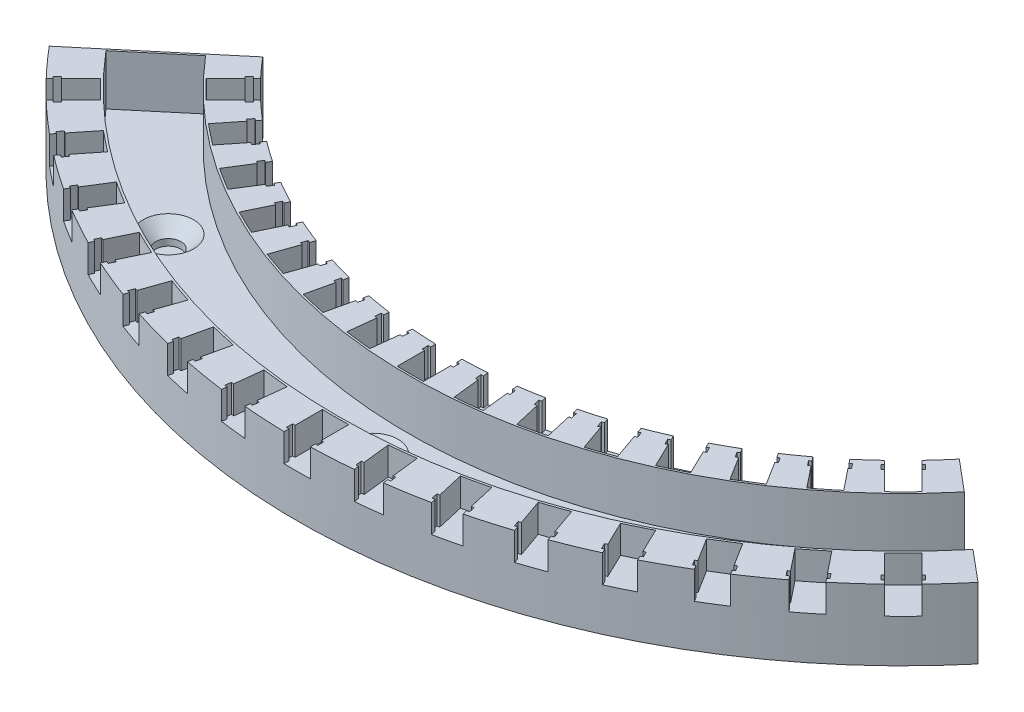
from build123d import *

# Parameters (mm, degrees)
BOSS_EXTRUDE1_DEPTH             = 4
BOSS_EXTRUDE2_START             = 10
BOSS_EXTRUDE2_DEPTH             = 10
SKETCH2_W                       = 5.2
SKETCH2_H                       = 1.2
SKETCH2_W_2                     = 0.5
SKETCH2_H_2                     = 5.837563394
SKETCH2_H_3                     = 1
CUT_EXTRUDE1_DEPTH              = 5.5
CIRPATTERN1_COUNT               = 8
CIRPATTERN1_ANGLE               = 45
CIRPATTERN1_THE_OTHER_WAY_COUNT = 8
CIRPATTERN1_THE_OTHER_WAY_ANGLE = 45
BOSS_EXTRUDE3_START             = 10
BOSS_EXTRUDE3_DEPTH             = 10
SKETCH4_R                       = 2.5
CUT_EXTRUDE2_DEPTH              = 3.8
CHAMFER1_SIZE                   = 2.5


with BuildPart() as part:
    # Sketch1 → Boss-Extrude1 (new body)
    with BuildSketch(Plane(origin=(0, 0, 0), x_dir=(1, 0, 0), z_dir=(0, 1, 0))):
        with BuildLine():
            ThreePointArc((68.943999881, -57.850884872), (38.035643557, -81.567700833), (0, -90))
            Line((0, -90), (0, -98))
            ThreePointArc((0, -98), (41.416589651, -88.81816313), (75.072355426, -62.993185749))
            Line((75.072355426, -62.993185749), (68.943999881, -57.850884872))
        make_face()
        with BuildLine():
            Line((0, -98), (0, -90))
            ThreePointArc((0, -90), (-38.035643557, -81.567700833), (-68.943999881, -57.850884872))
            Line((-68.943999881, -57.850884872), (-75.072355426, -62.993185749))
            ThreePointArc((-75.072355426, -62.993185749), (-41.416589651, -88.81816313), (0, -98))
        make_face()
        with BuildLine():
            Line((0, -112), (0, -98))
            ThreePointArc((0, -98), (-41.416589651, -88.81816313), (-75.072355426, -62.993185749))
            Line((-75.072355426, -62.993185749), (-85.796977629, -71.992212285))
            ThreePointArc((-85.796977629, -71.992212285), (-47.333245315, -101.506472148), (0, -112))
        make_face()
        with BuildLine():
            Line((0, -120), (0, -112))
            ThreePointArc((0, -112), (-47.333245315, -101.506472148), (-85.796977629, -71.992212285))
            Line((-85.796977629, -71.992212285), (-91.925333174, -77.134513162))
            ThreePointArc((-91.925333174, -77.134513162), (-50.714191409, -108.756934444), (0, -120))
        make_face()
        with BuildLine():
            ThreePointArc((75.072355426, -62.993185749), (41.416589651, -88.81816313), (0, -98))
            Line((0, -98), (0, -112))
            ThreePointArc((0, -112), (47.333245315, -101.506472148), (85.796977629, -71.992212285))
            Line((85.796977629, -71.992212285), (75.072355426, -62.993185749))
        make_face()
        with BuildLine():
            ThreePointArc((85.796977629, -71.992212285), (47.333245315, -101.506472148), (0, -112))
            Line((0, -112), (0, -120))
            ThreePointArc((0, -120), (50.714191409, -108.756934444), (91.925333174, -77.134513162))
            Line((91.925333174, -77.134513162), (85.796977629, -71.992212285))
        make_face()
    extrude(amount=-BOSS_EXTRUDE1_DEPTH)

    # Sketch1<3> → Boss-Extrude2 (add)
    with BuildSketch(Plane(origin=(0, 0, 0), x_dir=(1, 0, 0), z_dir=(0, 1, 0)).offset(BOSS_EXTRUDE2_START)):
        with BuildLine():
            Line((0, -98), (0, -90))
            ThreePointArc((0, -90), (-38.035643557, -81.567700833), (-68.943999881, -57.850884872))
            Line((-68.943999881, -57.850884872), (-75.072355426, -62.993185749))
            ThreePointArc((-75.072355426, -62.993185749), (-41.416589651, -88.81816313), (0, -98))
        make_face()
        with BuildLine():
            ThreePointArc((68.943999881, -57.850884872), (38.035643557, -81.567700833), (0, -90))
            Line((0, -90), (0, -98))
            ThreePointArc((0, -98), (41.416589651, -88.81816313), (75.072355426, -62.993185749))
            Line((75.072355426, -62.993185749), (68.943999881, -57.850884872))
        make_face()
        with BuildLine():
            ThreePointArc((85.796977629, -71.992212285), (47.333245315, -101.506472148), (0, -112))
            Line((0, -112), (0, -120))
            ThreePointArc((0, -120), (50.714191409, -108.756934444), (91.925333174, -77.134513162))
            Line((91.925333174, -77.134513162), (85.796977629, -71.992212285))
        make_face()
        with BuildLine():
            Line((0, -120), (0, -112))
            ThreePointArc((0, -112), (-47.333245315, -101.506472148), (-85.796977629, -71.992212285))
            Line((-85.796977629, -71.992212285), (-91.925333174, -77.134513162))
            ThreePointArc((-91.925333174, -77.134513162), (-50.714191409, -108.756934444), (0, -120))
        make_face()
    extrude(amount=-BOSS_EXTRUDE2_DEPTH)

    # Sketch2 → Cut-Extrude1 (cut)
    with BuildSketch(Plane(origin=(0, 10, 0), x_dir=(1, 0, 0), z_dir=(0, 1, 0))):
        with BuildLine():
            Line((-2.6, -111.969817362), (-2.6, -117.8))
            Line((-2.6, -117.8), (2.6, -117.8))
            Line((2.6, -117.8), (2.6, -111.969817362))
            ThreePointArc((2.6, -111.969817362), (0, -112), (-2.6, -111.969817362))
        make_face()
        with Locations((0, -118.4)):
            Rectangle(SKETCH2_W, SKETCH2_H)
        with Locations((2.85, -118.4)):
            Rectangle(SKETCH2_W_2, SKETCH2_H)
        with Locations((-2.85, -118.4)):
            Rectangle(SKETCH2_W_2, SKETCH2_H)
        with BuildLine():
            ThreePointArc((-2.6, -119.971830027), (-1.3000763, -119.9929573), (0, -120))
            ThreePointArc((0, -120), (1.3000763, -119.9929573), (2.6, -119.971830027))
            Line((2.6, -119.971830027), (2.6, -119))
            Line((2.6, -119), (-2.6, -119))
            Line((-2.6, -119), (-2.6, -119.971830027))
        make_face()
        with Locations((0, -95.081218303)):
            Rectangle(SKETCH2_W, SKETCH2_H_2)
        with Locations((0, -91.562436606)):
            Rectangle(SKETCH2_W, SKETCH2_H)
        with Locations((-2.85, -91.562436606)):
            Rectangle(SKETCH2_W_2, SKETCH2_H)
        with Locations((0, -90.462436606)):
            Rectangle(SKETCH2_W, SKETCH2_H_3)
        with Locations((2.85, -91.562436606)):
            Rectangle(SKETCH2_W_2, SKETCH2_H)
    cut_extrude1 = extrude(amount=-CUT_EXTRUDE1_DEPTH, mode=Mode.SUBTRACT)

    # CirPattern1: Cut-Extrude1 ×8 about axis
    cirpattern1_axis = Axis((0, 0, 0), (0, -1, 0))
    for i in range(1, CIRPATTERN1_COUNT):
        add(cut_extrude1.rotate(cirpattern1_axis, i * CIRPATTERN1_ANGLE / (CIRPATTERN1_COUNT - 1)), mode=Mode.SUBTRACT)

    # CirPattern1 the other way: Cut-Extrude1 ×8 about axis
    cirpattern1_the_other_way_axis = Axis((0, 0, 0), (0, 1, 0))
    for i in range(1, CIRPATTERN1_THE_OTHER_WAY_COUNT):
        add(cut_extrude1.rotate(cirpattern1_the_other_way_axis, i * CIRPATTERN1_THE_OTHER_WAY_ANGLE / (CIRPATTERN1_THE_OTHER_WAY_COUNT - 1)), mode=Mode.SUBTRACT)

    # Sketch3 → Boss-Extrude3 (add)
    with BuildSketch(Plane(origin=(0, 0, 0), x_dir=(1, 0, 0), z_dir=(0, 1, 0)).offset(BOSS_EXTRUDE3_START)):
        with BuildLine():
            Line((-85.539315409, -72.298170927), (-74.814615037, -63.2990788))
            ThreePointArc((-74.814615037, -63.2990788), (-74.9436413, -63.146263775), (-75.072355426, -62.993185749))
            Line((-75.072355426, -62.993185749), (-85.796977629, -71.992212285))
            ThreePointArc((-85.796977629, -71.992212285), (-85.668283108, -72.145306634), (-85.539315409, -72.298170927))
        make_face()
        with BuildLine():
            ThreePointArc((-74.765937648, -62.736070705), (0, -97.6), (74.765937648, -62.736070705))
            Line((74.765937648, -62.736070705), (75.072355426, -62.993185749))
            ThreePointArc((75.072355426, -62.993185749), (0, -98), (-75.072355426, -62.993185749))
            Line((-75.072355426, -62.993185749), (-74.765937648, -62.736070705))
        make_face()
        with BuildLine():
            ThreePointArc((86.103395407, -72.249327329), (0, -112.4), (-86.103395407, -72.249327329))
            Line((-86.103395407, -72.249327329), (-85.796977629, -71.992212285))
            ThreePointArc((-85.796977629, -71.992212285), (0, -112), (85.796977629, -71.992212285))
            Line((85.796977629, -71.992212285), (86.103395407, -72.249327329))
        make_face()
    extrude(amount=-BOSS_EXTRUDE3_DEPTH)

    # Sketch4 → Cut-Extrude2 (cut)
    with BuildSketch(Plane(origin=(0, 0, 0), x_dir=(1, 0, 0), z_dir=(0, 1, 0))):
        with Locations(Location((0, -105, 0), (0, 0, 270))):
            Circle(SKETCH4_R)
        with Locations(Location((57.881154425, -87.605775851, 0), (0, 0, 270))):
            Circle(SKETCH4_R)
        with Locations(Location((-57.881154425, -87.605775851, 0), (0, 0, 270))):
            Circle(SKETCH4_R)
    extrude(amount=-CUT_EXTRUDE2_DEPTH, mode=Mode.SUBTRACT)

    # Chamfer1
    chamfer1_edges = [part.edges().sort_by_distance(p)[0] for p in [
        (0, 0, 102.5),
        (57.881154425, 0, 85.105775851),
        (-57.881154425, 0, 85.105775851),
    ]]
    chamfer(chamfer1_edges, length=CHAMFER1_SIZE)


solid = part.part
